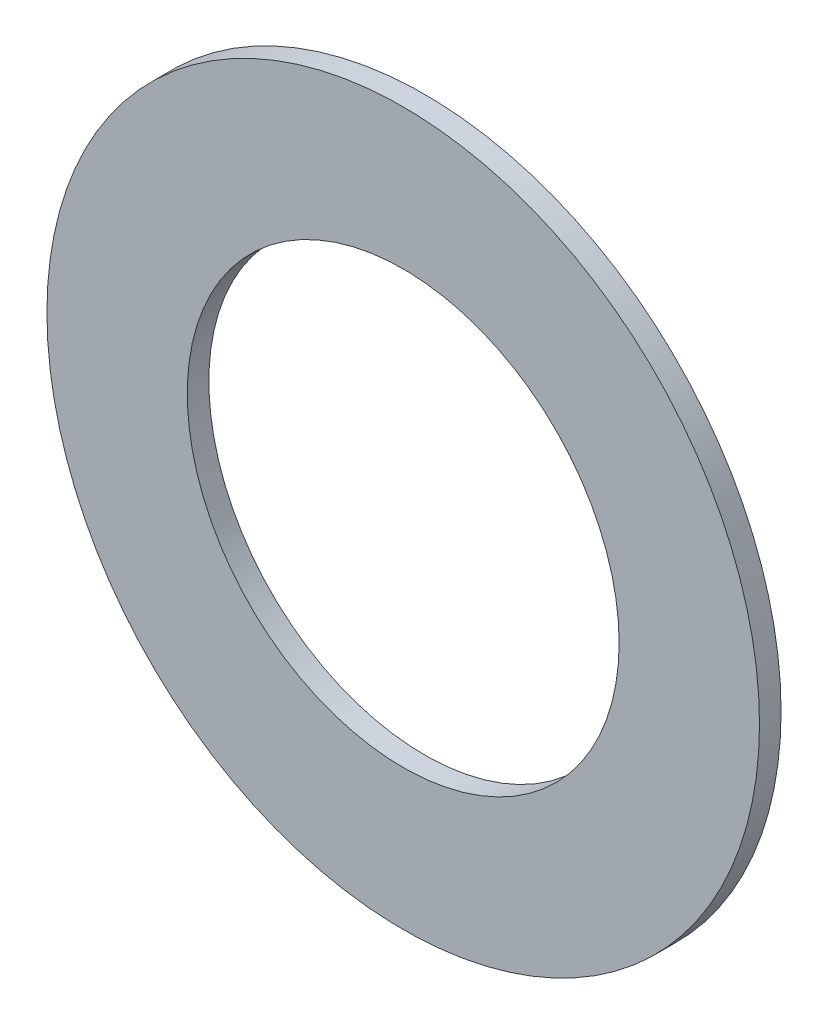
from build123d import *

# Parameters (mm, degrees)
SKETCH1_R               = 16.5
BOSS_EXTRUDE1_DEPTH     = 1
CUT_EXTRUDE1_DEPTH      = 24.355941428
CUT_EXTRUDE1_DEPTH_BACK = 24.355941428
SKETCH2_R               = 10


with BuildPart() as part:
    # Sketch1 → Boss-Extrude1 (new body)
    with BuildSketch(Plane.XY):
        Circle(SKETCH1_R)
    extrude(amount=BOSS_EXTRUDE1_DEPTH)

    # Sketch2 → Cut-Extrude1 (cut, two sides: drawn at the far end of the back side and taken through both)
    with BuildSketch(Plane.XY.offset(-CUT_EXTRUDE1_DEPTH_BACK)):
        Circle(SKETCH2_R)
    extrude(amount=CUT_EXTRUDE1_DEPTH + CUT_EXTRUDE1_DEPTH_BACK, mode=Mode.SUBTRACT)


solid = part.part
